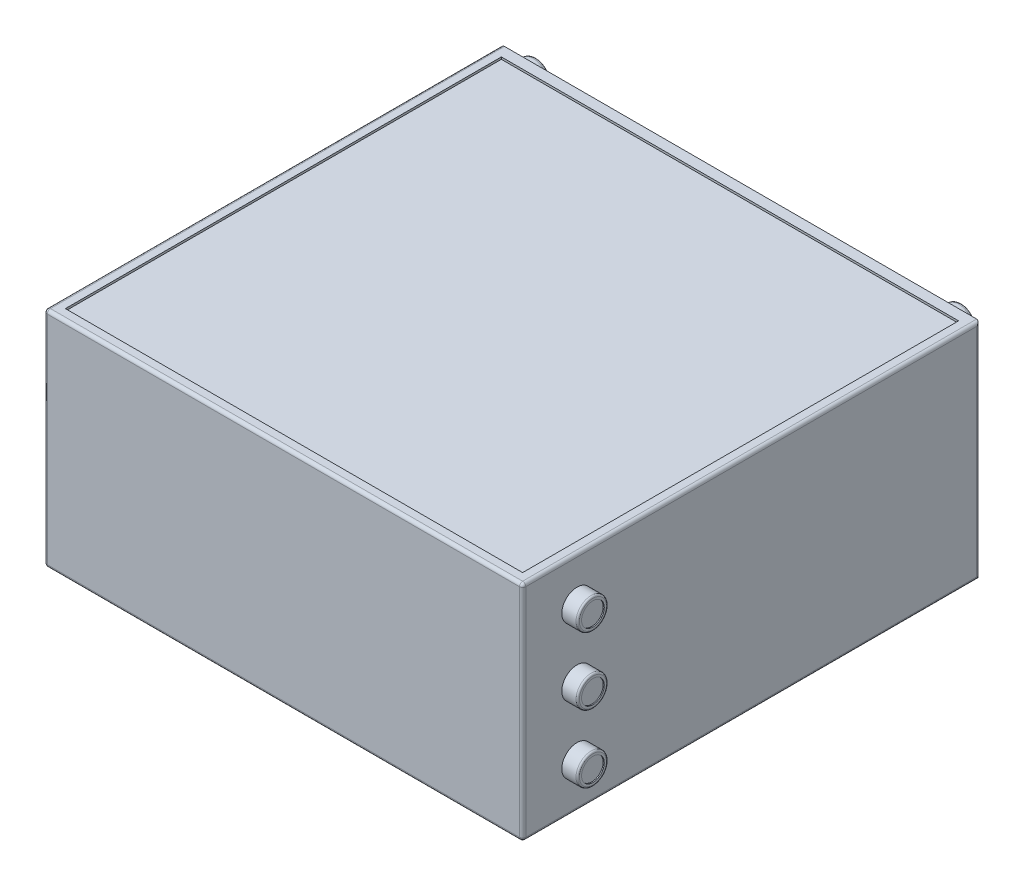
from build123d import *

# Parameters (mm, degrees)
SKETCH2_W             = 450
SKETCH2_H             = 210
BOSS_EXTRUDE1_DEPTH   = 430
SKETCH3_W             = 430
SKETCH3_H             = 410
CUT_EXTRUDE1_DEPTH    = 2
FILLET1_R             = 3
SKETCH4_R             = 14.283033336
BOSS_EXTRUDE2_DEPTH   = 15
BOSS_EXTRUDE2_2_DEPTH = 15
BOSS_EXTRUDE2_3_DEPTH = 15
FILLET2_R             = 1.6
FILLET3_R             = 1.6
FILLET4_R             = 1.6
SKETCH5_R             = 10.683033336
CUT_EXTRUDE2_DEPTH    = 1
SKETCH6_R             = 3
CUT_EXTRUDE3_DEPTH    = 10
SKETCH7_R             = 14.365093361
BOSS_EXTRUDE3_DEPTH   = 8
BOSS_EXTRUDE3_2_DEPTH = 8
BOSS_EXTRUDE3_3_DEPTH = 8
BOSS_EXTRUDE3_4_DEPTH = 8
FILLET5_R             = 3
FILLET6_R             = 3
FILLET7_R             = 3
FILLET8_R             = 3


with BuildPart() as part:
    # Sketch2 → Boss-Extrude1 (new body)
    with BuildSketch(Plane.XY):
        with Locations((1982.8602, -11.9002)):
            Rectangle(SKETCH2_W, SKETCH2_H)
    extrude(amount=BOSS_EXTRUDE1_DEPTH)

    # Sketch3 → Cut-Extrude1 (cut)
    with BuildSketch(Plane.XZ.offset(116.9002)):
        with Locations((1982.8602, 215)):
            Rectangle(SKETCH3_W, SKETCH3_H)
    cut_extrude1 = extrude(amount=-CUT_EXTRUDE1_DEPTH, mode=Mode.SUBTRACT)

    # Mirror1: Cut-Extrude1 across plane
    add(cut_extrude1.mirror(Plane(origin=(0, -11.9002, 0), x_dir=(0, 0, 1), z_dir=(0, -1, 0))), mode=Mode.SUBTRACT)

    # Fillet1
    fillet1_edges = [part.edges().sort_by_distance(p)[0] for p in [
        (1982.8602, -116.9002, 430),
        (2207.8602, -11.9002, 430),
        (1982.8602, 93.0998, 430),
        (2207.8602, -11.9002, 0),
        (1757.8602, -11.9002, 0),
        (1757.8602, -11.9002, 430),
        (2207.8602, 93.0998, 215),
        (2207.8602, -116.9002, 215),
        (1757.8602, -116.9002, 215),
        (1757.8602, 93.0998, 215),
    ]]
    fillet(fillet1_edges, radius=FILLET1_R)

    # Sketch6 → Cut-Extrude3 (cut)
    with BuildSketch(Plane(origin=(0, 0, 0), x_dir=(-1, 0, 0), z_dir=(0, 0, -1))):
        with Locations((-2182.8602, 50.5998)):
            Circle(SKETCH6_R)
        with Locations((-1782.8602, 50.5998)):
            Circle(SKETCH6_R)
        with Locations((-1782.8602, -74.4002)):
            Circle(SKETCH6_R)
        with Locations((-2182.8602, -74.4002)):
            Circle(SKETCH6_R)
    extrude(amount=-CUT_EXTRUDE3_DEPTH, mode=Mode.SUBTRACT)


with BuildPart() as body_2:
    # Sketch4 → Boss-Extrude2 (new body)
    with BuildSketch(Plane(origin=(2207.8602, 0, 0), x_dir=(0, 0, -1), z_dir=(1, 0, 0))):
        with Locations((-378.89990273, 51.405376306)):
            Circle(SKETCH4_R)
    extrude(amount=BOSS_EXTRUDE2_DEPTH)

    # Fillet4
    fillet4_edges = [body_2.edges().sort_by_distance(p)[0] for p in [
        (2222.8602, 51.405376306, 393.182936066),
    ]]
    fillet(fillet4_edges, radius=FILLET4_R)


with BuildPart() as body_3:
    # Sketch4 → Boss-Extrude2 2 (new body)
    with BuildSketch(Plane(origin=(2207.8602, 0, 0), x_dir=(0, 0, -1), z_dir=(1, 0, 0))):
        with Locations(Location((-378.89990273, -75.205776306, 0), (0, 0, 180))):
            Circle(SKETCH4_R)
    extrude(amount=BOSS_EXTRUDE2_2_DEPTH)

    # Fillet2
    fillet2_edges = [body_3.edges().sort_by_distance(p)[0] for p in [
        (2222.8602, -75.205776306, 364.616869394),
    ]]
    fillet(fillet2_edges, radius=FILLET2_R)


with BuildPart() as body_4:
    # Sketch4 → Boss-Extrude2 3 (new body)
    with BuildSketch(Plane(origin=(2207.8602, 0, 0), x_dir=(0, 0, -1), z_dir=(1, 0, 0))):
        with Locations((-378.89990273, -11.9002)):
            Circle(SKETCH4_R)
    extrude(amount=BOSS_EXTRUDE2_3_DEPTH)

    # Fillet3
    fillet3_edges = [body_4.edges().sort_by_distance(p)[0] for p in [
        (2222.8602, -11.9002, 393.182936066),
    ]]
    fillet(fillet3_edges, radius=FILLET3_R)


with BuildPart() as cut_extrude2_tool:
    # Sketch5 → Cut-Extrude2 (new body)
    with BuildSketch(Plane(origin=(2222.8602, 0, 0), x_dir=(0, 0, -1), z_dir=(1, 0, 0))):
        with Locations((-378.89990273, 51.405376306)):
            Circle(SKETCH5_R)
        with Locations((-378.89990273, -11.9002)):
            Circle(SKETCH5_R)
        with Locations((-378.89990273, -75.205776306)):
            Circle(SKETCH5_R)
    extrude(amount=-CUT_EXTRUDE2_DEPTH)


with BuildPart() as body_2_1:
    add(body_2.part)

    # Cut-Extrude2: cut by cut_extrude2_tool
    add(cut_extrude2_tool.part, mode=Mode.SUBTRACT)


with BuildPart() as body_3_1:
    add(body_3.part)

    # Cut-Extrude2: cut by cut_extrude2_tool
    add(cut_extrude2_tool.part, mode=Mode.SUBTRACT)


with BuildPart() as body_4_1:
    add(body_4.part)

    # Cut-Extrude2: cut by cut_extrude2_tool
    add(cut_extrude2_tool.part, mode=Mode.SUBTRACT)


with BuildPart() as body_5:
    # Sketch7 → Boss-Extrude3 (new body)
    with BuildSketch(Plane(origin=(0, 0, 0), x_dir=(-1, 0, 0), z_dir=(0, 0, -1))):
        with Locations((-2182.8602, 77.40293411)):
            Circle(SKETCH7_R)
    extrude(amount=BOSS_EXTRUDE3_DEPTH)

    # Fillet6
    fillet6_edges = [body_5.edges().sort_by_distance(p)[0] for p in [
        (2197.225293361, 77.40293411, -8),
    ]]
    fillet(fillet6_edges, radius=FILLET6_R)


with BuildPart() as body_6:
    # Sketch7 → Boss-Extrude3 2 (new body)
    with BuildSketch(Plane(origin=(0, 0, 0), x_dir=(-1, 0, 0), z_dir=(0, 0, -1))):
        with Locations(Location((-1782.8602, 77.40293411, 0), (0, 0, 180))):
            Circle(SKETCH7_R)
    extrude(amount=BOSS_EXTRUDE3_2_DEPTH)

    # Fillet7
    fillet7_edges = [body_6.edges().sort_by_distance(p)[0] for p in [
        (1768.495106639, 77.40293411, -8),
    ]]
    fillet(fillet7_edges, radius=FILLET7_R)


with BuildPart() as body_7:
    # Sketch7 → Boss-Extrude3 3 (new body)
    with BuildSketch(Plane(origin=(0, 0, 0), x_dir=(-1, 0, 0), z_dir=(0, 0, -1))):
        with Locations((-1782.8602, -101.20333411)):
            Circle(SKETCH7_R)
    extrude(amount=BOSS_EXTRUDE3_3_DEPTH)

    # Fillet8
    fillet8_edges = [body_7.edges().sort_by_distance(p)[0] for p in [
        (1797.225293361, -101.20333411, -8),
    ]]
    fillet(fillet8_edges, radius=FILLET8_R)


with BuildPart() as body_8:
    # Sketch7 → Boss-Extrude3 4 (new body)
    with BuildSketch(Plane(origin=(0, 0, 0), x_dir=(-1, 0, 0), z_dir=(0, 0, -1))):
        with Locations(Location((-2182.8602, -101.20333411, 0), (0, 0, 180))):
            Circle(SKETCH7_R)
    extrude(amount=BOSS_EXTRUDE3_4_DEPTH)

    # Fillet5
    fillet5_edges = [body_8.edges().sort_by_distance(p)[0] for p in [
        (2168.495106639, -101.20333411, -8),
    ]]
    fillet(fillet5_edges, radius=FILLET5_R)


solid = Compound([part.part, body_2_1.part, body_3_1.part, body_4_1.part, body_5.part, body_6.part, body_7.part, body_8.part])
